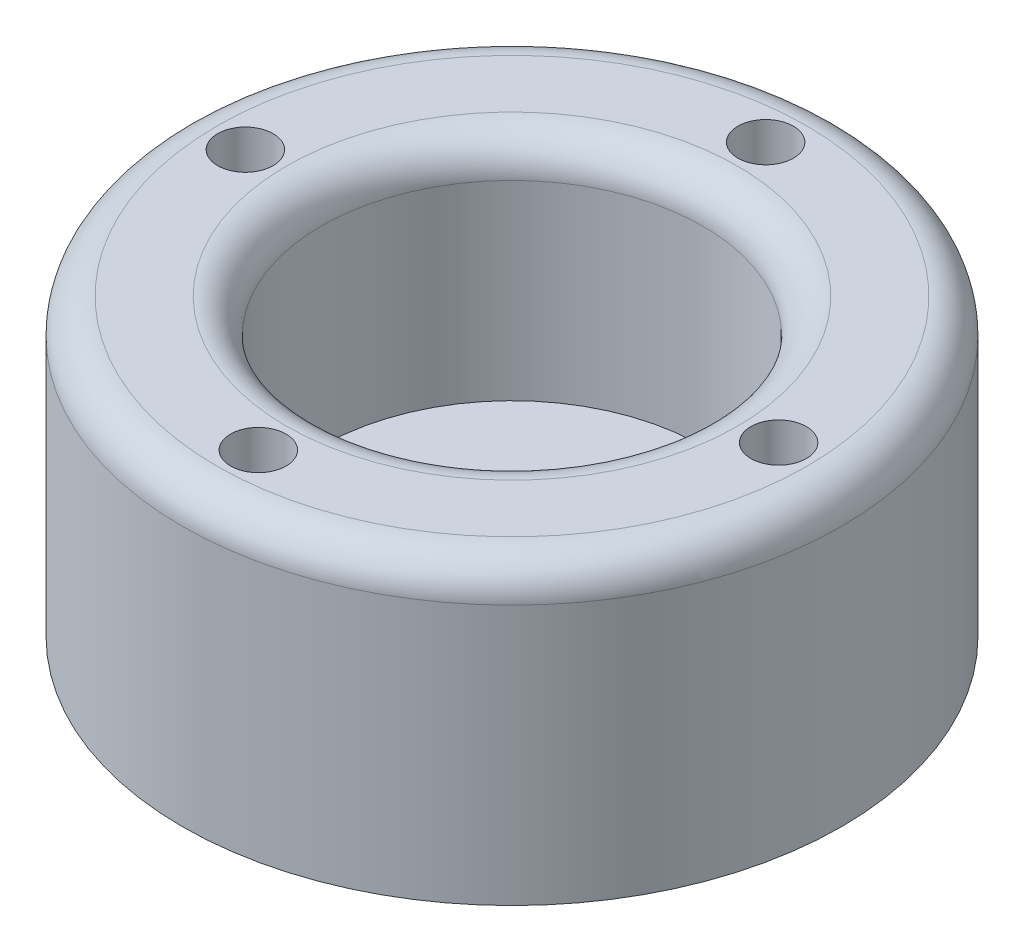
from build123d import *

# Parameters (mm, degrees)
SKETCH1_R           = 19
SKETCH1_R_2         = 4.75
BOSS_EXTRUDE1_DEPTH = 17
SKETCH2_R           = 1.25
CUT_EXTRUDE1_DEPTH  = 32.796226191
SKETCH3_R           = 1.6
CUT_EXTRUDE2_DEPTH  = 15
SKETCH4_R           = 11
SKETCH4_R_2         = 1.25
SKETCH4_R_3         = 4.75
CUT_EXTRUDE4_DEPTH  = 13
FILLET3_R           = 2


with BuildPart() as part:
    # Sketch1 → Boss-Extrude1 (new body)
    with BuildSketch(Plane(origin=(0, 0, 0), x_dir=(1, 0, 0), z_dir=(0, 1, 0))):
        with Locations(Location((0, 0, 0), (0, 0, 270))):
            Circle(SKETCH1_R)
        with Locations(Location((0, 0, 0), (0, 0, 270))):
            Circle(SKETCH1_R_2, mode=Mode.SUBTRACT)
    extrude(amount=BOSS_EXTRUDE1_DEPTH)

    # Sketch2 → Cut-Extrude1 (cut, through all)
    with BuildSketch(Plane(origin=(0, 17, 0), x_dir=(1, 0, 0), z_dir=(0, 1, 0))):
        with Locations(Location((-0.373838074, 7.25, 0), (0, 0, 270))):
            Circle(SKETCH2_R)
        with Locations(Location((7.25, 0.373838074, 0), (0, 0, 270))):
            Circle(SKETCH2_R)
        with Locations(Location((0.373838074, -7.25, 0), (0, 0, 270))):
            Circle(SKETCH2_R)
        with Locations(Location((-7.25, -0.373838074, 0), (0, 0, 270))):
            Circle(SKETCH2_R)
    extrude(amount=-CUT_EXTRUDE1_DEPTH, mode=Mode.SUBTRACT)

    # Sketch3 → Cut-Extrude2 (cut)
    with BuildSketch(Plane(origin=(0, 17, 0), x_dir=(1, 0, 0), z_dir=(0, 1, 0))):
        with Locations(Location((-0.373838074, 15, 0), (0, 0, 270))):
            Circle(SKETCH3_R)
        with Locations(Location((15, 0.373838074, 0), (0, 0, 270))):
            Circle(SKETCH3_R)
        with Locations(Location((0.373838074, -15, 0), (0, 0, 270))):
            Circle(SKETCH3_R)
        with Locations(Location((-15, -0.373838074, 0), (0, 0, 270))):
            Circle(SKETCH3_R)
    extrude(amount=-CUT_EXTRUDE2_DEPTH, mode=Mode.SUBTRACT)

    # Sketch4 → Cut-Extrude4 (cut)
    with BuildSketch(Plane(origin=(0, 17, 0), x_dir=(1, 0, 0), z_dir=(0, 1, 0))):
        with Locations(Location((0, 0, 0), (0, 0, 270))):
            Circle(SKETCH4_R)
        with Locations(Location((-0.373838074, 7.25, 0), (0, 0, 270))):
            Circle(SKETCH4_R_2, mode=Mode.SUBTRACT)
        with Locations(Location((0.373838074, -7.25, 0), (0, 0, 270))):
            Circle(SKETCH4_R_2, mode=Mode.SUBTRACT)
        with Locations(Location((0, 0, 0), (0, 0, 270))):
            Circle(SKETCH4_R_3, mode=Mode.SUBTRACT)
        with Locations(Location((-7.25, -0.373838074, 0), (0, 0, 270))):
            Circle(SKETCH4_R_2, mode=Mode.SUBTRACT)
        with Locations(Location((7.25, 0.373838074, 0), (0, 0, 270))):
            Circle(SKETCH4_R_2, mode=Mode.SUBTRACT)
    extrude(amount=-CUT_EXTRUDE4_DEPTH, mode=Mode.SUBTRACT)

    # Fillet3
    fillet3_edges = [part.edges().sort_by_distance(p)[0] for p in [
        (0, 17, -11),
        (0, 17, -19),
    ]]
    fillet(fillet3_edges, radius=FILLET3_R)


solid = part.part
